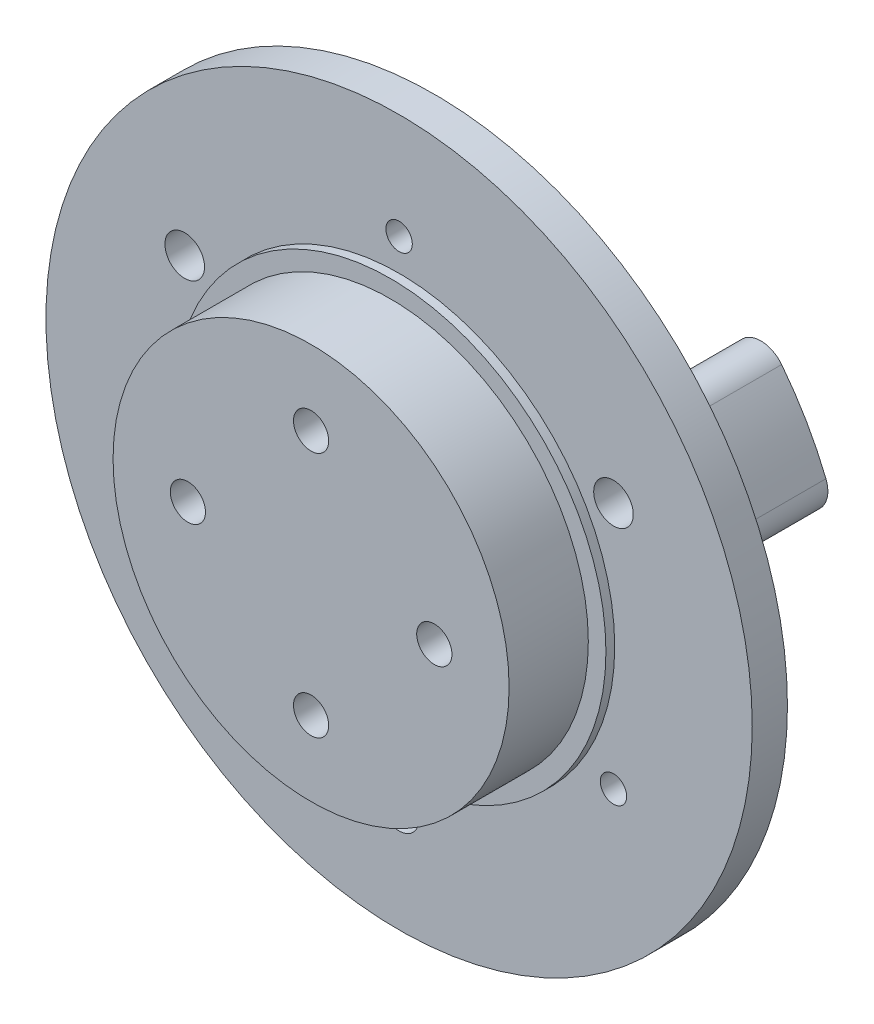
from build123d import *
from build123d.topology import SkipClean

# Parameters (mm, degrees)
SKETCH1_R                = 40.125
SKETCH1_R_2              = 6
BOSS_EXTRUDE1_DEPTH      = 4
SKETCH1_3_R              = 6
BOSS_EXTRUDE2_DEPTH      = 4.8
SKETCH2_R                = 7
SKETCH2_R_2              = 6
BOSS_EXTRUDE3_DEPTH      = 1
SKETCH3_R                = 22.5
BOSS_EXTRUDE4_DEPTH      = 10
SKETCH3_3_R              = 24.5
SKETCH3_3_R_2            = 22.5
BOSS_EXTRUDE5_DEPTH      = 1
SKETCH4_R                = 2
CUT_EXTRUDE1_DEPTH       = 60.778518299
SKETCH5_R                = 1.5
CUT_EXTRUDE2_DEPTH       = 60.778518299
SKETCH6_R                = 2.25
CUT_EXTRUDE3_DEPTH       = 5
SKETCH7_R                = 2.8
CUT_EXTRUDE4_DEPTH       = 5
CIRPATTERN2_COUNT        = 4
SKETCH8_R                = 1.5
BOSS_EXTRUDE6_DEPTH      = 11
FILLET1_R                = 3
SKETCH8_2_R              = 1.5
CUT_EXTRUDE5_DEPTH       = 59.446824122
CIRPATTERN3_COUNT        = 3
FILLET1_OF_CIRPATTERN3_R = 3
CIRPATTERN1_COUNT        = 6
SKETCH6_2_R              = 2.25
SKETCH6_2_R_2            = 1.5
BOSS_EXTRUDE7_DEPTH      = 5


with BuildPart() as part:
    # Sketch1 → Boss-Extrude1 (new body)
    # profile 1 of 4: a face of its own
    with BuildSketch(Plane.XY):
        Circle(SKETCH1_R)
        with Locations((0, 28.125)):
            Circle(SKETCH1_R_2, mode=Mode.SUBTRACT)
        with Locations((24.356964481, -14.0625)):
            Circle(SKETCH1_R_2, mode=Mode.SUBTRACT)
        with Locations((-24.356964481, -14.0625)):
            Circle(SKETCH1_R_2, mode=Mode.SUBTRACT)
    # profile 2 of 4: a face of its own
    with BuildSketch(Plane.XY):
        with Locations((0, 28.125)):
            Circle(SKETCH1_R_2)
    # profile 3 of 4: a face of its own
    with BuildSketch(Plane.XY):
        with Locations((-24.356964481, -14.0625)):
            Circle(SKETCH1_R_2)
    # profile 4 of 4: a face of its own
    with BuildSketch(Plane.XY):
        with Locations((24.356964481, -14.0625)):
            Circle(SKETCH1_R_2)
    extrude(amount=BOSS_EXTRUDE1_DEPTH)

    # Sketch1<3> → Boss-Extrude2 (add)
    with BuildSketch(Plane.XY):
        with Locations((0, 28.125)):
            Circle(SKETCH1_3_R)
        with Locations((24.356964481, -14.0625)):
            Circle(SKETCH1_3_R)
        with Locations((-24.356964481, -14.0625)):
            Circle(SKETCH1_3_R)
    extrude(amount=-BOSS_EXTRUDE2_DEPTH)

    # Sketch2 → Boss-Extrude3 (add)
    # profile 1 of 3: a face of its own
    with BuildSketch(Plane(origin=(0, 0, 0), x_dir=(-1, 0, 0), z_dir=(0, 0, -1))):
        with Locations(Location((0, 28.125, 0), (0, 0, 180))):
            Circle(SKETCH2_R)
        with Locations(Location((0, 28.125, 0), (0, 0, 180))):
            Circle(SKETCH2_R_2, mode=Mode.SUBTRACT)
    # profile 2 of 3: a face of its own
    with BuildSketch(Plane(origin=(0, 0, 0), x_dir=(-1, 0, 0), z_dir=(0, 0, -1))):
        with Locations(Location((-24.356964481, -14.0625, 0), (0, 0, 180))):
            Circle(SKETCH2_R)
        with Locations(Location((-24.356964481, -14.0625, 0), (0, 0, 180))):
            Circle(SKETCH2_R_2, mode=Mode.SUBTRACT)
    # profile 3 of 3: a face of its own
    with BuildSketch(Plane(origin=(0, 0, 0), x_dir=(-1, 0, 0), z_dir=(0, 0, -1))):
        with Locations(Location((24.356964481, -14.0625, 0), (0, 0, 180))):
            Circle(SKETCH2_R)
        with Locations(Location((24.356964481, -14.0625, 0), (0, 0, 180))):
            Circle(SKETCH2_R_2, mode=Mode.SUBTRACT)
    extrude(amount=BOSS_EXTRUDE3_DEPTH)

    # Sketch3 → Boss-Extrude4 (add)
    with BuildSketch(Plane.XY.offset(4)):
        Circle(SKETCH3_R)
    extrude(amount=BOSS_EXTRUDE4_DEPTH)

    # Sketch3<3> → Boss-Extrude5 (add)
    with BuildSketch(Plane.XY.offset(4)):
        Circle(SKETCH3_3_R)
        Circle(SKETCH3_3_R_2, mode=Mode.SUBTRACT)
    extrude(amount=BOSS_EXTRUDE5_DEPTH)

    # Sketch4 → Cut-Extrude1 (cut, through all)
    with BuildSketch(Plane.XY.offset(14)):
        with Locations((0, 14)):
            Circle(SKETCH4_R)
        with Locations((14, 0)):
            Circle(SKETCH4_R)
        with Locations((0, -14)):
            Circle(SKETCH4_R)
        with Locations((-14, 0)):
            Circle(SKETCH4_R)
    extrude(amount=-CUT_EXTRUDE1_DEPTH, mode=Mode.SUBTRACT)

    # Sketch5 → Cut-Extrude2 (cut, through all)
    with BuildSketch(Plane(origin=(0, 0, -4.8), x_dir=(-1, 0, 0), z_dir=(0, 0, -1))):
        with Locations((0, 28.125)):
            Circle(SKETCH5_R)
        with Locations((24.356964481, -14.0625)):
            Circle(SKETCH5_R)
        with Locations((-24.356964481, -14.0625)):
            Circle(SKETCH5_R)
    extrude(amount=-CUT_EXTRUDE2_DEPTH, mode=Mode.SUBTRACT)

    # Sketch6 → Cut-Extrude3 (cut)
    with BuildSketch(Plane.XY.offset(4)):
        with Locations((0, 28.125)):
            Circle(SKETCH6_R)
    cut_extrude3 = extrude(amount=-CUT_EXTRUDE3_DEPTH, mode=Mode.SUBTRACT)

    # Sketch7 → Cut-Extrude4 (cut)
    with BuildSketch(Plane(origin=(0, 0, 0), x_dir=(-1, 0, 0), z_dir=(0, 0, -1))):
        with Locations((0, 14)):
            Circle(SKETCH7_R)
    cut_extrude4 = extrude(amount=-CUT_EXTRUDE4_DEPTH, mode=Mode.SUBTRACT)

    # CirPattern2: Cut-Extrude4 ×4 about axis
    cirpattern2_axis = Axis((0, 0, 0), (0, 0, 1))
    for i in range(1, CIRPATTERN2_COUNT):
        add(cut_extrude4.rotate(cirpattern2_axis, i * 360 / CIRPATTERN2_COUNT), mode=Mode.SUBTRACT)

    # Sketch8 → Boss-Extrude6 (add)
    with BuildSketch(Plane(origin=(0, 0, 0), x_dir=(-1, 0, 0), z_dir=(0, 0, -1))):
        with BuildLine():
            Line((-26.05133243, 25.026859644), (-15.696526212, 12.595026394))
            ThreePointArc((-15.696526212, 12.595026394), (-17.428761251, 10.0625), (-18.755875925, 7.296077254))
            Line((-18.755875925, 7.296077254), (-34.699562443, 10.047685865))
            ThreePointArc((-34.699562443, 10.047685865), (-31.285167712, 18.0625), (-26.05133243, 25.026859644))
        make_face()
        with Locations((-24.356964481, 14.0625)):
            Circle(SKETCH8_R, mode=Mode.SUBTRACT)
    boss_extrude6 = extrude(amount=BOSS_EXTRUDE6_DEPTH)

    # Fillet1
    fillet1_edges = [part.edges().sort_by_distance(p)[0] for p in [
        (26.05133243, 25.026859644, -5.5),
        (34.699562443, 10.047685865, -5.5),
        (18.755875925, 7.296077254, -5.5),
        (15.696526212, 12.595026394, -5.5),
    ]]
    fillet(fillet1_edges, radius=FILLET1_R)

    # Sketch8<2> → Cut-Extrude5 (cut, through all)
    with SkipClean():  # the faces are left unmerged after this step: merging them gives an invalid solid
        with BuildSketch(Plane(origin=(0, 0, 0), x_dir=(-1, 0, 0), z_dir=(0, 0, -1))):
            with Locations(Location((-24.356964481, 14.0625, 0), (0, 0, 180))):
                Circle(SKETCH8_2_R)
        cut_extrude5 = extrude(amount=-CUT_EXTRUDE5_DEPTH, mode=Mode.SUBTRACT)

    # CirPattern3: Boss-Extrude6, Cut-Extrude5 ×3 about axis
    cirpattern3_axis = Axis((0, 0, 0), (0, 0, 1))
    add([boss_extrude6.rotate(cirpattern3_axis, i * 360 / CIRPATTERN3_COUNT) for i in range(1, CIRPATTERN3_COUNT)])
    add([cut_extrude5.rotate(cirpattern3_axis, i * 360 / CIRPATTERN3_COUNT) for i in range(1, CIRPATTERN3_COUNT)], mode=Mode.SUBTRACT)

    # Fillet1 of CirPattern3
    fillet1_of_cirpattern3_edges = [part.edges().sort_by_distance(p)[0] for p in [
        (-34.699562443, 10.047685865, -5.5),
        (-26.05133243, 25.026859644, -5.5),
        (-15.696526212, 12.595026394, -5.5),
        (-18.755875925, 7.296077254, -5.5),
        (8.648230013, -35.074545509, -5.5),
        (-8.648230013, -35.074545509, -5.5),
        (-3.059349712, -19.891103648, -5.5),
        (3.059349712, -19.891103648, -5.5),
    ]]
    fillet(fillet1_of_cirpattern3_edges, radius=FILLET1_OF_CIRPATTERN3_R)

    # CirPattern1: Cut-Extrude3 ×6 about axis, 2 skipped
    cirpattern1_axis = Axis((0, 0, 0), (0, 0, 1))
    add([cut_extrude3.rotate(cirpattern1_axis, i * 360 / CIRPATTERN1_COUNT) for i in range(1, CIRPATTERN1_COUNT) if i not in (2, 4)], mode=Mode.SUBTRACT)

    # Sketch6<2> → Boss-Extrude7 (add)
    with BuildSketch(Plane.XY.offset(4)):
        with Locations((0, 28.125)):
            Circle(SKETCH6_2_R)
        with Locations(Location((0, 28.125, 0), (0, 0, 180))):
            Circle(SKETCH6_2_R_2, mode=Mode.SUBTRACT)
    extrude(amount=-BOSS_EXTRUDE7_DEPTH)


solid = part.part
